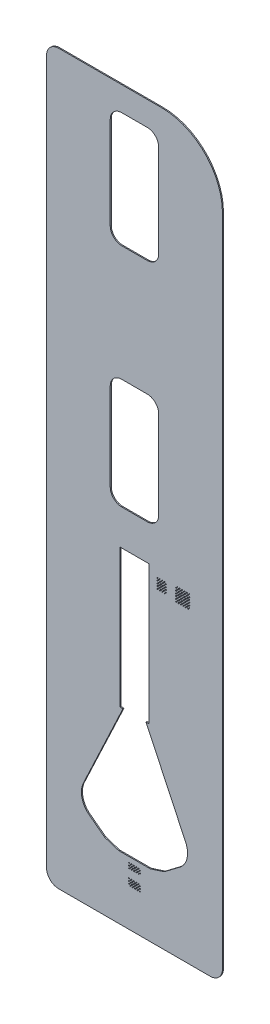
from build123d import *

# Parameters (mm, degrees)
BOSS_EXTRUDE2_DEPTH = 0.17
CUT_EXTRUDE1_DEPTH  = 62.727456614
SKETCH5_R           = 0.075
CUT_EXTRUDE2_DEPTH  = 62.727456735
SKETCH6_R           = 0.075
CUT_EXTRUDE3_DEPTH  = 62.727456735


with BuildPart() as part:
    # Sketch3 → Boss-Extrude2 (new body)
    with BuildSketch(Plane.XY):
        with BuildLine():
            Line((-12.5, 60), (4.5, 60))
            ThreePointArc((4.5, 60), (11.571067812, 57.071067812), (14.5, 50))
            Line((14.5, 50), (14.5, -58))
            ThreePointArc((14.5, -58), (13.914213562, -59.414213562), (12.5, -60))
            Line((12.5, -60), (-12.5, -60))
            ThreePointArc((-12.5, -60), (-13.914213562, -59.414213562), (-14.5, -58))
            Line((-14.5, -58), (-14.5, 58))
            ThreePointArc((-14.5, 58), (-13.914213562, 59.414213562), (-12.5, 60))
        make_face()
    extrude(amount=BOSS_EXTRUDE2_DEPTH)

    # Sketch4 → Cut-Extrude1 (cut, through all)
    with BuildSketch(Plane.XY.offset(0.17)):
        with BuildLine():
            Line((2.1, 56), (-2.1, 56))
            ThreePointArc((-2.1, 56), (-3.443502884, 55.443502884), (-4, 54.1))
            Line((-4, 54.1), (-4, 38.9))
            ThreePointArc((-4, 38.9), (-3.443502884, 37.556497116), (-2.1, 37))
            Line((-2.1, 37), (2.1, 37))
            ThreePointArc((2.1, 37), (3.443502884, 37.556497116), (4, 38.9))
            Line((4, 38.9), (4, 54.1))
            ThreePointArc((4, 54.1), (3.443502884, 55.443502884), (2.1, 56))
        make_face()
        with BuildLine():
            Line((2.1, 17.931829774), (-2.1, 17.931829774))
            ThreePointArc((-2.1, 17.931829774), (-3.443502884, 17.375332658), (-4, 16.031829774))
            Line((-4, 16.031829774), (-4, 1.6))
            ThreePointArc((-4, 1.6), (-3.443502884, 0.256497116), (-2.1, -0.3))
            Line((-2.1, -0.3), (2.1, -0.3))
            ThreePointArc((2.1, -0.3), (3.443502884, 0.256497116), (4, 1.6))
            Line((4, 1.6), (4, 16.031829774))
            ThreePointArc((4, 16.031829774), (3.443502884, 17.375332658), (2.1, 17.931829774))
        make_face()
        with BuildLine():
            add(Edge.make_bspline(
                [(7.4, -46.97314145), (8.211440188, -46.416320927), (8.75059415, -45.427724457), (8.75, -44.3)],
                knots=[3, 3, 3, 3, 3.998304655, 3.998304655, 3.998304655, 3.998304655], degree=3))
            add(Edge.make_bspline(
                [(8.75, -44.3), (8.749703343, -43.736930638), (8.614001568, -43.20601542), (8.375, -42.75)],
                knots=[2, 2, 2, 2, 3, 3, 3, 3], degree=3))
            Line((8.375, -42.75), (1.9, -29))
            Line((1.9, -29), (2.4, -29))
            Line((2.4, -29), (2.4, -6.15))
            Line((2.4, -6.15), (-2.4, -6.15))
            Line((-2.4, -6.15), (-2.4, -29))
            Line((-2.4, -29), (-1.9, -29))
            Line((-1.9, -29), (-8.375, -42.75))
            add(Edge.make_bspline(
                [(-8.375, -42.75), (-8.614001568, -43.20601542), (-8.749703343, -43.736930638), (-8.75, -44.3)],
                knots=[2, 2, 2, 2, 3, 3, 3, 3], degree=3))
            add(Edge.make_bspline(
                [(-8.75, -44.3), (-8.75059415, -45.427724457), (-8.211440188, -46.416320927), (-7.4, -46.97314145)],
                knots=[3, 3, 3, 3, 3.998304655, 3.998304655, 3.998304655, 3.998304655], degree=3))
            Line((-7.4, -46.97314145), (-4.925, -48.85))
            Line((-4.925, -48.85), (-2.6, -49.6))
            Line((-2.6, -49.6), (2.6, -49.6))
            Line((2.6, -49.6), (4.925, -48.85))
            Line((4.925, -48.85), (7.4, -46.97314145))
        make_face()
    extrude(amount=-CUT_EXTRUDE1_DEPTH, mode=Mode.SUBTRACT)

    # Sketch5 → Cut-Extrude2 (cut, through all)
    with BuildSketch(Plane.XY.offset(0.17)):
        with Locations((-0.9, -50.5)):
            Circle(SKETCH5_R)
        with Locations((-0.5, -50.5)):
            Circle(SKETCH5_R)
        with Locations((-0.1, -50.5)):
            Circle(SKETCH5_R)
        with Locations((0.3, -50.5)):
            Circle(SKETCH5_R)
        with Locations((0.7, -50.5)):
            Circle(SKETCH5_R)
        with Locations((-0.7, -50.7)):
            Circle(SKETCH5_R)
        with Locations((-0.3, -50.7)):
            Circle(SKETCH5_R)
        with Locations((0.1, -50.7)):
            Circle(SKETCH5_R)
        with Locations((0.5, -50.7)):
            Circle(SKETCH5_R)
        with Locations((0.9, -50.7)):
            Circle(SKETCH5_R)
        with Locations((-0.9, -52.7)):
            Circle(SKETCH5_R)
        with Locations((-0.5, -50.9)):
            Circle(SKETCH5_R)
        with Locations((-0.1, -50.9)):
            Circle(SKETCH5_R)
        with Locations((0.3, -50.9)):
            Circle(SKETCH5_R)
        with Locations((0.7, -50.9)):
            Circle(SKETCH5_R)
        with Locations((-0.7, -51.1)):
            Circle(SKETCH5_R)
        with Locations((-0.3, -51.1)):
            Circle(SKETCH5_R)
        with Locations((0.1, -51.1)):
            Circle(SKETCH5_R)
        with Locations((0.5, -51.1)):
            Circle(SKETCH5_R)
        with Locations((0.9, -51.1)):
            Circle(SKETCH5_R)
        with Locations((-0.5, -51.3)):
            Circle(SKETCH5_R)
        with Locations((-0.1, -51.3)):
            Circle(SKETCH5_R)
        with Locations((0.3, -51.3)):
            Circle(SKETCH5_R)
        with Locations((0.7, -51.3)):
            Circle(SKETCH5_R)
        with Locations((-0.9, -50.9)):
            Circle(SKETCH5_R)
        with Locations((-0.9, -51.3)):
            Circle(SKETCH5_R)
        with Locations((-0.5, -52.7)):
            Circle(SKETCH5_R)
        with Locations((-0.1, -52.7)):
            Circle(SKETCH5_R)
        with Locations((0.3, -52.7)):
            Circle(SKETCH5_R)
        with Locations((0.7, -52.7)):
            Circle(SKETCH5_R)
        with Locations((-0.7, -52.9)):
            Circle(SKETCH5_R)
        with Locations((-0.3, -52.9)):
            Circle(SKETCH5_R)
        with Locations((0.1, -52.9)):
            Circle(SKETCH5_R)
        with Locations((0.5, -52.9)):
            Circle(SKETCH5_R)
        with Locations((0.9, -52.9)):
            Circle(SKETCH5_R)
        with Locations((-0.5, -53.1)):
            Circle(SKETCH5_R)
        with Locations((-0.1, -53.1)):
            Circle(SKETCH5_R)
        with Locations((0.3, -53.1)):
            Circle(SKETCH5_R)
        with Locations((0.7, -53.1)):
            Circle(SKETCH5_R)
        with Locations((-0.7, -53.3)):
            Circle(SKETCH5_R)
        with Locations((-0.3, -53.3)):
            Circle(SKETCH5_R)
        with Locations((0.1, -53.3)):
            Circle(SKETCH5_R)
        with Locations((0.5, -53.3)):
            Circle(SKETCH5_R)
        with Locations((0.9, -53.3)):
            Circle(SKETCH5_R)
        with Locations((-0.5, -53.5)):
            Circle(SKETCH5_R)
        with Locations((-0.1, -53.5)):
            Circle(SKETCH5_R)
        with Locations((0.3, -53.5)):
            Circle(SKETCH5_R)
        with Locations((0.7, -53.5)):
            Circle(SKETCH5_R)
        with Locations((-0.7, -53.7)):
            Circle(SKETCH5_R)
        with Locations((-0.3, -53.7)):
            Circle(SKETCH5_R)
        with Locations((0.1, -53.7)):
            Circle(SKETCH5_R)
        with Locations((0.5, -53.7)):
            Circle(SKETCH5_R)
        with Locations((0.9, -53.7)):
            Circle(SKETCH5_R)
        with Locations((-0.9, -53.1)):
            Circle(SKETCH5_R)
        with Locations((-0.9, -53.5)):
            Circle(SKETCH5_R)
    extrude(amount=-CUT_EXTRUDE2_DEPTH, mode=Mode.SUBTRACT)

    # Sketch6 → Cut-Extrude3 (cut, through all)
    with BuildSketch(Plane.XY.offset(0.17)):
        with Locations((3.78, -9.07)):
            Circle(SKETCH6_R)
        with Locations((4.18, -9.07)):
            Circle(SKETCH6_R)
        with Locations((4.58, -9.07)):
            Circle(SKETCH6_R)
        with Locations((4.98, -9.07)):
            Circle(SKETCH6_R)
        with Locations((3.98, -8.87)):
            Circle(SKETCH6_R)
        with Locations((4.38, -8.87)):
            Circle(SKETCH6_R)
        with Locations((4.78, -8.87)):
            Circle(SKETCH6_R)
        with Locations((5.18, -8.87)):
            Circle(SKETCH6_R)
        with Locations((4.18, -8.67)):
            Circle(SKETCH6_R)
        with Locations((4.58, -8.67)):
            Circle(SKETCH6_R)
        with Locations((4.98, -8.67)):
            Circle(SKETCH6_R)
        with Locations((3.98, -8.47)):
            Circle(SKETCH6_R)
        with Locations((4.38, -8.47)):
            Circle(SKETCH6_R)
        with Locations((4.78, -8.47)):
            Circle(SKETCH6_R)
        with Locations((5.18, -8.47)):
            Circle(SKETCH6_R)
        with Locations((4.18, -8.27)):
            Circle(SKETCH6_R)
        with Locations((4.58, -8.27)):
            Circle(SKETCH6_R)
        with Locations((4.98, -8.27)):
            Circle(SKETCH6_R)
        with Locations((3.98, -8.07)):
            Circle(SKETCH6_R)
        with Locations((4.38, -8.07)):
            Circle(SKETCH6_R)
        with Locations((4.78, -8.07)):
            Circle(SKETCH6_R)
        with Locations((5.18, -8.07)):
            Circle(SKETCH6_R)
        with Locations((4.18, -7.87)):
            Circle(SKETCH6_R)
        with Locations((4.58, -7.87)):
            Circle(SKETCH6_R)
        with Locations((4.98, -7.87)):
            Circle(SKETCH6_R)
        with Locations((3.98, -7.67)):
            Circle(SKETCH6_R)
        with Locations((4.38, -7.67)):
            Circle(SKETCH6_R)
        with Locations((4.78, -7.67)):
            Circle(SKETCH6_R)
        with Locations((5.18, -7.67)):
            Circle(SKETCH6_R)
        with Locations((4.18, -7.47)):
            Circle(SKETCH6_R)
        with Locations((4.58, -7.47)):
            Circle(SKETCH6_R)
        with Locations((4.98, -7.47)):
            Circle(SKETCH6_R)
        with Locations((3.78, -8.67)):
            Circle(SKETCH6_R)
        with Locations((3.78, -8.27)):
            Circle(SKETCH6_R)
        with Locations((3.78, -7.87)):
            Circle(SKETCH6_R)
        with Locations((3.78, -7.47)):
            Circle(SKETCH6_R)
        with Locations((6.84, -9.37)):
            Circle(SKETCH6_R)
        with Locations((7.24, -9.37)):
            Circle(SKETCH6_R)
        with Locations((7.64, -9.37)):
            Circle(SKETCH6_R)
        with Locations((8.04, -9.37)):
            Circle(SKETCH6_R)
        with Locations((8.44, -9.37)):
            Circle(SKETCH6_R)
        with Locations((8.84, -9.37)):
            Circle(SKETCH6_R)
        with Locations((7.04, -9.17)):
            Circle(SKETCH6_R)
        with Locations((7.44, -9.17)):
            Circle(SKETCH6_R)
        with Locations((7.84, -9.17)):
            Circle(SKETCH6_R)
        with Locations((8.24, -9.17)):
            Circle(SKETCH6_R)
        with Locations((8.64, -9.17)):
            Circle(SKETCH6_R)
        with Locations((9.04, -9.17)):
            Circle(SKETCH6_R)
        with Locations((7.24, -8.97)):
            Circle(SKETCH6_R)
        with Locations((7.64, -8.97)):
            Circle(SKETCH6_R)
        with Locations((8.04, -8.97)):
            Circle(SKETCH6_R)
        with Locations((8.44, -8.97)):
            Circle(SKETCH6_R)
        with Locations((8.84, -8.97)):
            Circle(SKETCH6_R)
        with Locations((7.04, -8.77)):
            Circle(SKETCH6_R)
        with Locations((7.44, -8.77)):
            Circle(SKETCH6_R)
        with Locations((7.84, -8.77)):
            Circle(SKETCH6_R)
        with Locations((8.24, -8.77)):
            Circle(SKETCH6_R)
        with Locations((8.64, -8.77)):
            Circle(SKETCH6_R)
        with Locations((9.04, -8.77)):
            Circle(SKETCH6_R)
        with Locations((7.24, -8.57)):
            Circle(SKETCH6_R)
        with Locations((7.64, -8.57)):
            Circle(SKETCH6_R)
        with Locations((8.04, -8.57)):
            Circle(SKETCH6_R)
        with Locations((8.44, -8.57)):
            Circle(SKETCH6_R)
        with Locations((8.84, -8.57)):
            Circle(SKETCH6_R)
        with Locations((7.04, -8.37)):
            Circle(SKETCH6_R)
        with Locations((7.44, -8.37)):
            Circle(SKETCH6_R)
        with Locations((7.84, -8.37)):
            Circle(SKETCH6_R)
        with Locations((8.24, -8.37)):
            Circle(SKETCH6_R)
        with Locations((8.64, -8.37)):
            Circle(SKETCH6_R)
        with Locations((9.04, -8.37)):
            Circle(SKETCH6_R)
        with Locations((7.24, -8.17)):
            Circle(SKETCH6_R)
        with Locations((7.64, -8.17)):
            Circle(SKETCH6_R)
        with Locations((8.04, -8.17)):
            Circle(SKETCH6_R)
        with Locations((8.44, -8.17)):
            Circle(SKETCH6_R)
        with Locations((8.84, -8.17)):
            Circle(SKETCH6_R)
        with Locations((7.04, -7.97)):
            Circle(SKETCH6_R)
        with Locations((7.44, -7.97)):
            Circle(SKETCH6_R)
        with Locations((7.84, -7.97)):
            Circle(SKETCH6_R)
        with Locations((8.24, -7.97)):
            Circle(SKETCH6_R)
        with Locations((8.64, -7.97)):
            Circle(SKETCH6_R)
        with Locations((9.04, -7.97)):
            Circle(SKETCH6_R)
        with Locations((7.24, -7.77)):
            Circle(SKETCH6_R)
        with Locations((7.64, -7.77)):
            Circle(SKETCH6_R)
        with Locations((8.04, -7.77)):
            Circle(SKETCH6_R)
        with Locations((8.44, -7.77)):
            Circle(SKETCH6_R)
        with Locations((8.84, -7.77)):
            Circle(SKETCH6_R)
        with Locations((7.04, -7.57)):
            Circle(SKETCH6_R)
        with Locations((7.44, -7.57)):
            Circle(SKETCH6_R)
        with Locations((7.84, -7.57)):
            Circle(SKETCH6_R)
        with Locations((8.24, -7.57)):
            Circle(SKETCH6_R)
        with Locations((8.64, -7.57)):
            Circle(SKETCH6_R)
        with Locations((9.04, -7.57)):
            Circle(SKETCH6_R)
        with Locations((7.24, -7.37)):
            Circle(SKETCH6_R)
        with Locations((7.64, -7.37)):
            Circle(SKETCH6_R)
        with Locations((8.04, -7.37)):
            Circle(SKETCH6_R)
        with Locations((8.44, -7.37)):
            Circle(SKETCH6_R)
        with Locations((8.84, -7.37)):
            Circle(SKETCH6_R)
        with Locations((7.04, -7.17)):
            Circle(SKETCH6_R)
        with Locations((7.44, -7.17)):
            Circle(SKETCH6_R)
        with Locations((7.84, -7.17)):
            Circle(SKETCH6_R)
        with Locations((8.24, -7.17)):
            Circle(SKETCH6_R)
        with Locations((8.64, -7.17)):
            Circle(SKETCH6_R)
        with Locations((9.04, -7.17)):
            Circle(SKETCH6_R)
        with Locations((6.84, -8.97)):
            Circle(SKETCH6_R)
        with Locations((6.84, -8.57)):
            Circle(SKETCH6_R)
        with Locations((6.84, -8.17)):
            Circle(SKETCH6_R)
        with Locations((6.84, -7.77)):
            Circle(SKETCH6_R)
        with Locations((6.84, -7.37)):
            Circle(SKETCH6_R)
    extrude(amount=-CUT_EXTRUDE3_DEPTH, mode=Mode.SUBTRACT)


solid = part.part
